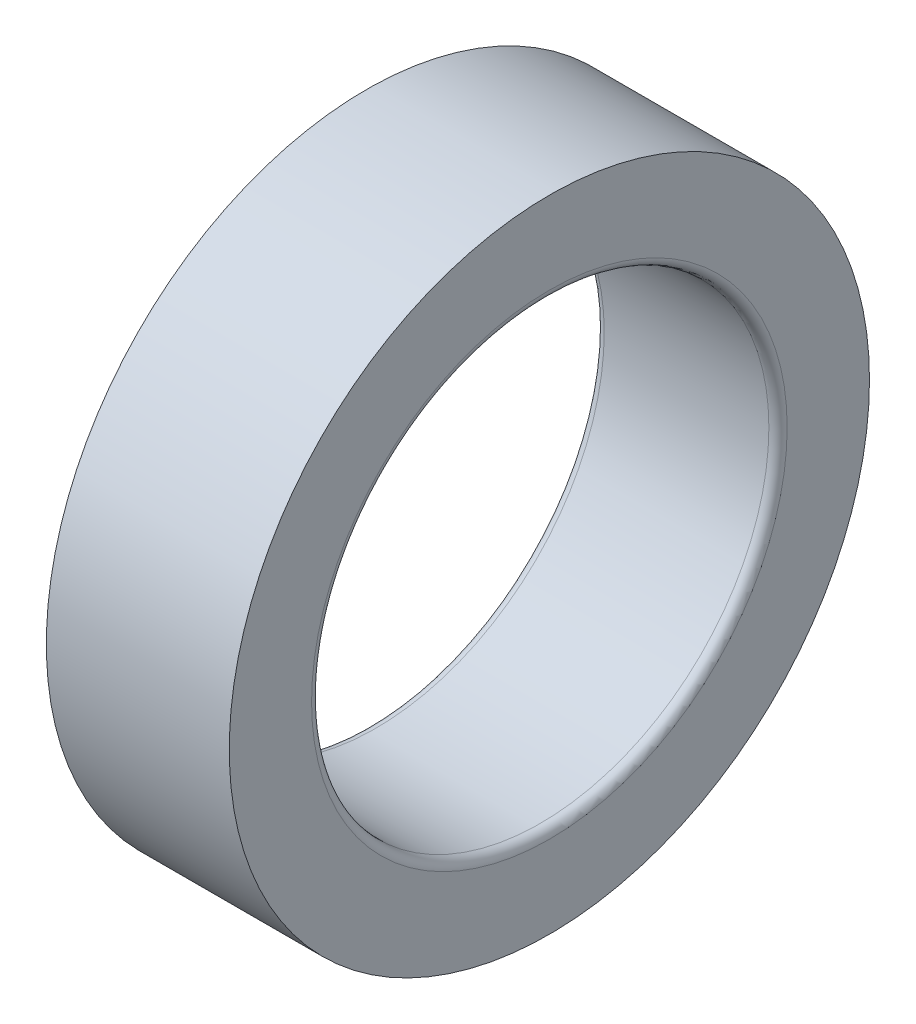
from build123d import *

# Parameters (mm, degrees)
SKETCH2_R           = 35
SKETCH2_R_2         = 25
BOSS_EXTRUDE1_DEPTH = 20
FILLET1_R           = 1


with BuildPart() as part:
    # Sketch2 → Boss-Extrude1 (new body)
    with BuildSketch(Plane(origin=(0, 0, 0), x_dir=(0, 0, -1), z_dir=(1, 0, 0))):
        Circle(SKETCH2_R)
        Circle(SKETCH2_R_2, mode=Mode.SUBTRACT)
    extrude(amount=BOSS_EXTRUDE1_DEPTH)

    # Fillet1
    fillet1_edges = [part.edges().sort_by_distance(p)[0] for p in [
        (0, 0, 25),
        (20, 0, 25),
    ]]
    fillet(fillet1_edges, radius=FILLET1_R)


solid = part.part
